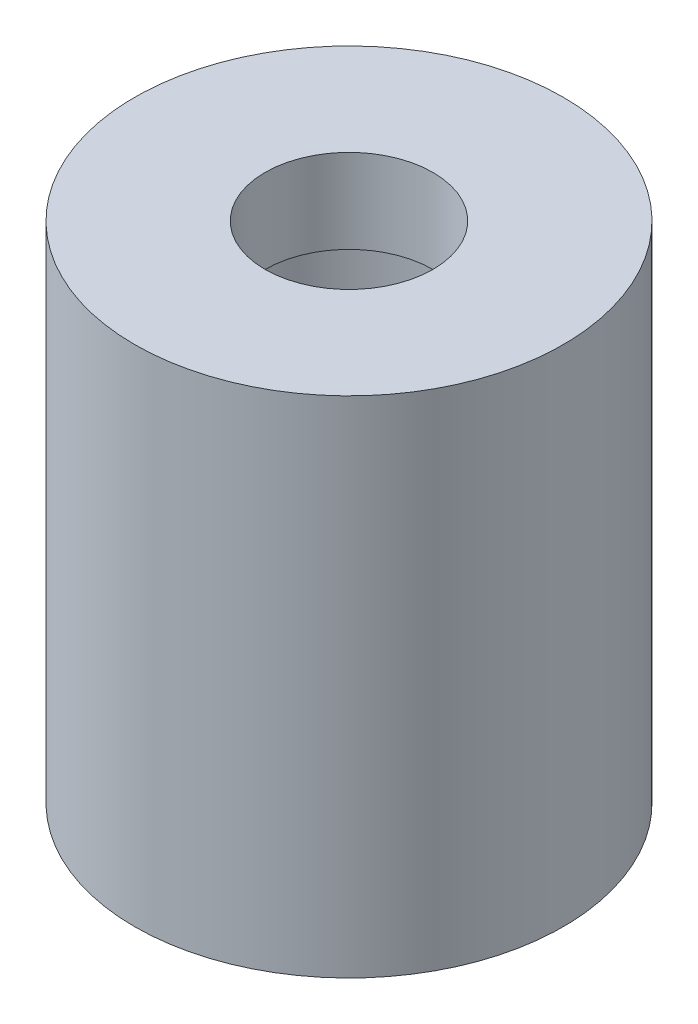
from build123d import *

# Parameters (mm, degrees)
SKETCH1_R           = 6.477
BOSS_EXTRUDE3_DEPTH = 15.24
SKETCH4_R           = 4.064
CUT_EXTRUDE2_DEPTH  = 12.7
SKETCH5_R           = 2.539011159
CUT_EXTRUDE3_DEPTH  = 12.7


with BuildPart() as part:
    # Sketch1 → Boss-Extrude3 (new body)
    with BuildSketch(Plane(origin=(0, 0, 0), x_dir=(1, 0, 0), z_dir=(0, 1, 0))):
        with Locations(Location((0, 0, 0), (0, 0, 90))):
            Circle(SKETCH1_R)
    extrude(amount=BOSS_EXTRUDE3_DEPTH)

    # Sketch4 → Cut-Extrude2 (cut)
    with BuildSketch(Plane.XZ):
        with Locations(Location((0, 0, 0), (0, 0, 270))):
            Circle(SKETCH4_R)
    extrude(amount=-CUT_EXTRUDE2_DEPTH, mode=Mode.SUBTRACT)

    # Sketch5 → Cut-Extrude3 (cut)
    with BuildSketch(Plane.XZ.offset(-12.7)):
        with Locations(Location((0, 0, 0), (0, 0, 270))):
            Circle(SKETCH5_R)
    extrude(amount=-CUT_EXTRUDE3_DEPTH, mode=Mode.SUBTRACT)


solid = part.part
